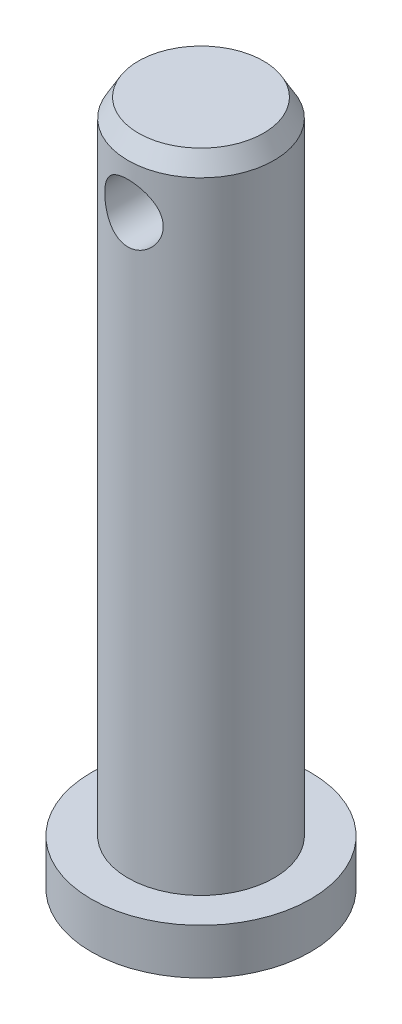
from build123d import *

# Parameters (mm, degrees)
CUT_EXTRUDE_1_DEPTH      = 39.448016854
CUT_EXTRUDE_1_DEPTH_BACK = 39.448016854
SKETCH_2_R               = 1.6


with BuildPart() as part:
    # 草图1 → 旋转1 (revolve)
    with BuildSketch(Plane.XY, mode=Mode.PRIVATE) as revolve_1_sk:
        Polygon((0, 0), (6, 0), (6, 2.5), (4, 2.5), (4, 36.5), (3.422649731, 37.5), (0, 37.5), align=None)
    revolve(revolve_1_sk.sketch.rotate(Axis((0, 0, 0), (0, -1, 0)), 90), axis=Axis((0, 0, 0), (0, -1, 0)))

    # 草图2 → 切除-拉伸1 (cut, two sides: drawn at the far end of the back side and taken through both)
    with BuildSketch(Plane.XY.offset(-CUT_EXTRUDE_1_DEPTH_BACK)):
        with Locations((0, 34)):
            Circle(SKETCH_2_R)
    extrude(amount=CUT_EXTRUDE_1_DEPTH + CUT_EXTRUDE_1_DEPTH_BACK, mode=Mode.SUBTRACT)


solid = part.part
